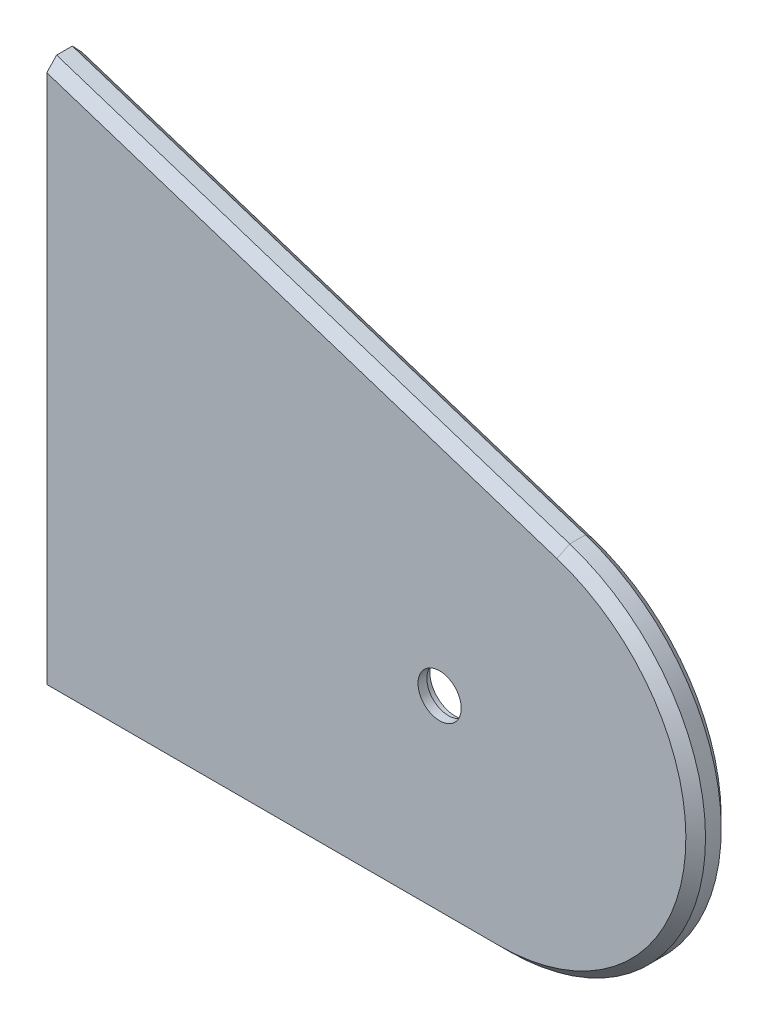
from build123d import *

# Parameters (mm, degrees)
SKETCH_1_R          = 11
EXTRUDE_1_DEPTH     = 8
FILLET_1_R          = 100
EXTRUDE_2_DEPTH     = 10
FILLET_2_R          = 10
CHAMFER_1_SIZE      = 5
SKETCH_4_R          = 13
CUT_EXTRUDE_1_DEPTH = 3.5


with BuildPart() as part:
    # 草图1 → 凸台-拉伸1 (new body)
    with BuildSketch(Plane.XY):
        Polygon((0, 0), (0, 280), (861.751390409, 0), align=None)
        with Locations((200, 100)):
            Circle(SKETCH_1_R, mode=Mode.SUBTRACT)
    extrude(amount=EXTRUDE_1_DEPTH)

    # 圆角1
    fillet_1_edges = [part.edges().sort_by_distance(p)[0] for p in [
        (861.751390409, 0, 4),
    ]]
    fillet(fillet_1_edges, radius=FILLET_1_R)

    # 草图2 → 凸台-拉伸2 (add)
    with BuildSketch(Plane.XY):
        with BuildLine():
            Line((0, 280), (0, 0))
            Line((0, 0), (230.376238942, 0))
            ThreePointArc((230.376238942, 0), (329.145073001, 84.356553496), (261.277938379, 195.10565163))
            Line((261.277938379, 195.10565163), (0, 280))
        make_face()
        with BuildLine():
            Line((230.376238942, 10), (30, 10))
            Line((30, 10), (151.410485182, 220.289128906))
            Line((151.410485182, 220.289128906), (258.187768435, 185.595086467))
            ThreePointArc((258.187768435, 185.595086467), (319.268189595, 85.920898146), (230.376238942, 10))
        make_face(mode=Mode.SUBTRACT)
        Polygon((10, 35.358983849), (10, 266.236180795), (122.241374643, 229.766747442), align=None, mode=Mode.SUBTRACT)
    extrude(amount=-EXTRUDE_2_DEPTH)

    # 圆角2
    fillet_2_edges = [part.edges().sort_by_distance(p)[0] for p in [
        (10, 35.358983849, -5),
        (30, 10, -5),
        (122.241374643, 229.766747442, -5),
        (151.410485182, 220.289128906, -5),
        (10, 266.236180795, -5),
    ]]
    fillet(fillet_2_edges, radius=FILLET_2_R)

    # 倒角1
    chamfer_1_edges = [part.edges().sort_by_distance(p)[0] for p in [
        (115.188119471, 0, 8),
        (130.63896919, 237.552825815, 8),
        (329.145073001, 84.356553496, 8),
        (130.63896919, 237.552825815, -10),
        (115.188119471, 0, -10),
        (329.145073001, 84.356553496, -10),
    ]]
    chamfer(chamfer_1_edges, length=CHAMFER_1_SIZE)

    # 草图4 → 切除-拉伸1 (cut)
    with BuildSketch(Plane(origin=(0, 0, 0), x_dir=(-1, 0, 0), z_dir=(0, 0, -1))):
        with Locations((-200, 100)):
            Circle(SKETCH_4_R)
    extrude(amount=-CUT_EXTRUDE_1_DEPTH, mode=Mode.SUBTRACT)


solid = part.part
